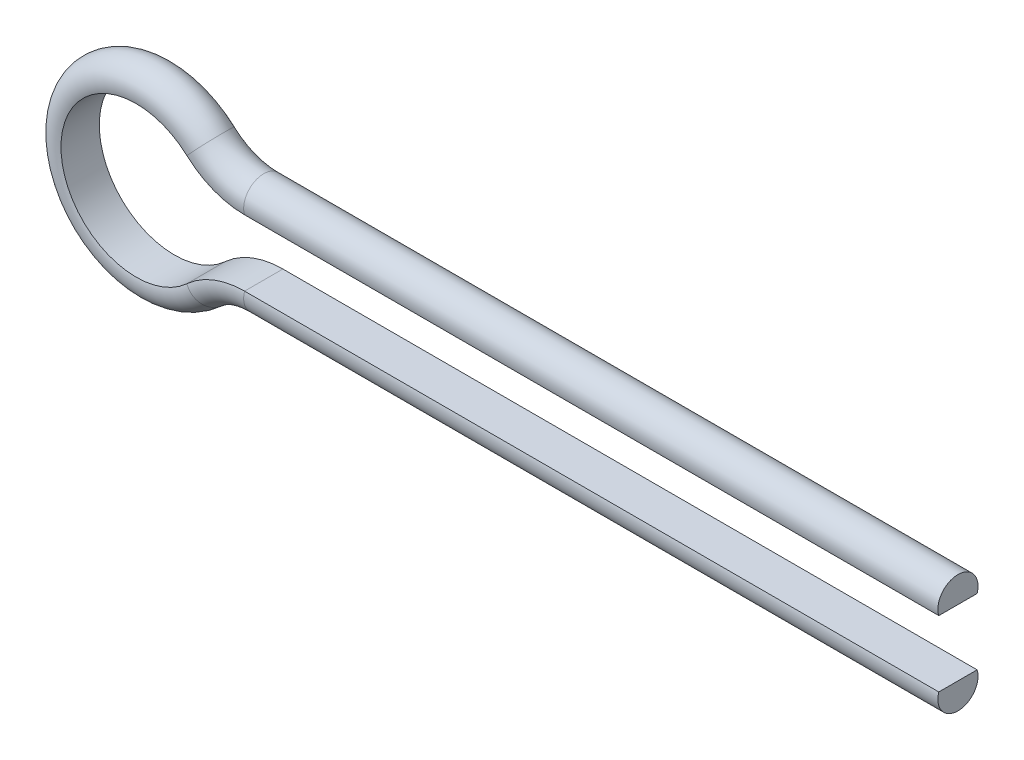
from build123d import *


with BuildPart() as part:
    # Sweep2: sweep along a path in Sketch1
    with BuildLine(Plane.XY) as sweep2_path:
        Line((100, 3.5), (13.506942659, 3.5))
        ThreePointArc((13.506942659, 3.5), (9.884098473, 4.179324059), (6.75347133, 6.125))
        ThreePointArc((6.75347133, 6.125), (-10, -1.25), (6.75347133, -8.625))
        ThreePointArc((6.75347133, -8.625), (9.884098473, -6.679324059), (13.506942659, -6))
        Line((13.506942659, -6), (100, -6))
    # Sketch3 → Sweep2 (sweep)
    with BuildSketch(Plane(origin=(100, 0, 0), x_dir=(0, 0, -1), z_dir=(1, 0, 0))):
        with BuildLine():
            Line((-2.387141941, 2.866299519), (2.387141941, 2.866299519))
            ThreePointArc((2.387141941, 2.866299519), (0, 6.108965901), (-2.387141941, 2.866299519))
        make_face()
    sweep(path=sweep2_path.line)


solid = part.part
